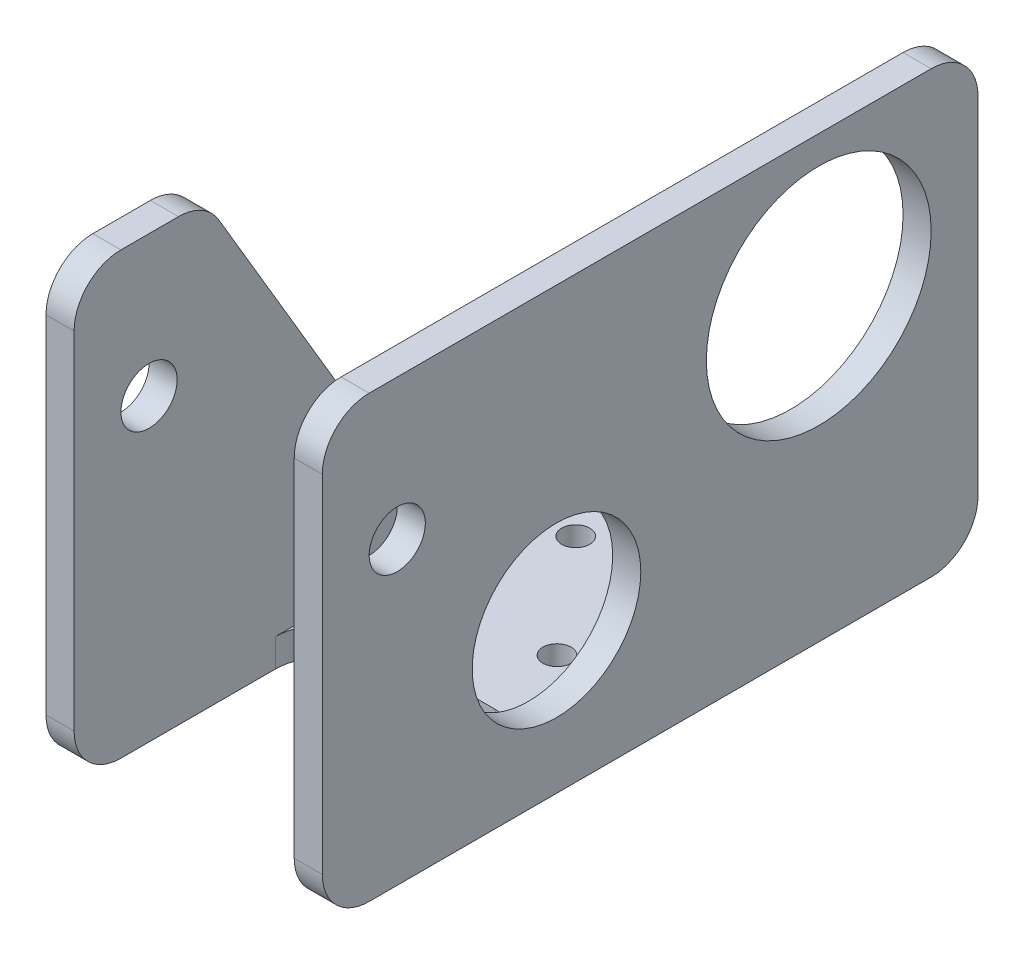
from build123d import *

# Parameters (mm, degrees)
SKETCH_1_W           = 29.5
SKETCH_1_H           = 47
EXTRUDE_1_DEPTH      = 70
SKETCH_2_W           = 23.5
SKETCH_2_H           = 44
CUT_EXTRUDE_1_DEPTH  = 70
SKETCH_5_R           = 12
SKETCH_5_R_2         = 3
CUT_EXTRUDE_4_DEPTH  = 70
SKETCH_10_R          = 9
CUT_EXTRUDE_8_DEPTH  = 17
SKETCH_11_W          = 23.5
SKETCH_11_H          = 26.5
SKETCH_11_H_2        = 15
CUT_EXTRUDE_9_DEPTH  = 10
FILLET_2_R           = 5
CUT_EXTRUDE_11_DEPTH = 10
FILLET_3_R           = 5
SKETCH_14_R          = 1.5
CUT_EXTRUDE_12_DEPTH = 10


with BuildPart() as part:
    # 草图1 → 凸台-拉伸1 (new body)
    with BuildSketch(Plane.XY):
        with Locations((14.75, 23.5)):
            Rectangle(SKETCH_1_W, SKETCH_1_H)
    extrude(amount=EXTRUDE_1_DEPTH)

    # 草图2 → 切除-拉伸1 (cut)
    with BuildSketch(Plane.XY.offset(70)):
        with Locations((14.75, 25)):
            Rectangle(SKETCH_2_W, SKETCH_2_H)
    extrude(amount=-CUT_EXTRUDE_1_DEPTH, mode=Mode.SUBTRACT)

    # 草图5 → 切除-拉伸4 (cut)
    with BuildSketch(Plane(origin=(29.5, 0, 0), x_dir=(0, 0, -1), z_dir=(1, 0, 0))):
        with Locations((-17, 32)):
            Circle(SKETCH_5_R)
        with Locations((-62, 32)):
            Circle(SKETCH_5_R_2)
    extrude(amount=-CUT_EXTRUDE_4_DEPTH, mode=Mode.SUBTRACT)

    # 草图10 → 切除-拉伸8 (cut)
    with BuildSketch(Plane(origin=(29.5, 0, 0), x_dir=(0, 0, -1), z_dir=(1, 0, 0))):
        with Locations((-45, 16)):
            Circle(SKETCH_10_R)
    extrude(amount=-CUT_EXTRUDE_8_DEPTH, mode=Mode.SUBTRACT)

    # 草图11 → 切除-拉伸9 (cut)
    with BuildSketch(Plane.XZ):
        with Locations((14.75, 56.75)):
            Rectangle(SKETCH_11_W, SKETCH_11_H)
        with Locations((14.75, 7.5)):
            Rectangle(SKETCH_11_W, SKETCH_11_H_2)
    extrude(amount=-CUT_EXTRUDE_9_DEPTH, mode=Mode.SUBTRACT)

    # 圆角2
    fillet_2_edges = [part.edges().sort_by_distance(p)[0] for p in [
        (1.5, 0, 0),
        (28, 0, 0),
        (28, 0, 70),
        (1.5, 0, 70),
        (3, 1.5, 43.5),
        (26.5, 1.5, 43.5),
    ]]
    fillet(fillet_2_edges, radius=FILLET_2_R)

    # 草图13 → 切除-拉伸11 (cut)
    with BuildSketch(Plane(origin=(3, 0, 0), x_dir=(0, 0, -1), z_dir=(1, 0, 0))):
        Polygon((-15, 0), (-15, 3), (-30, 3), (-56, 47), (0, 47), (0, 0), align=None)
    extrude(amount=-CUT_EXTRUDE_11_DEPTH, mode=Mode.SUBTRACT)

    # 圆角3
    fillet_3_edges = [part.edges().sort_by_distance(p)[0] for p in [
        (28, 47, 70),
        (0, 1.5, 15),
        (1.5, 3, 30),
        (1.5, 47, 56),
        (1.5, 47, 70),
        (28, 47, 0),
        (26.5, 1.5, 15),
    ]]
    fillet(fillet_3_edges, radius=FILLET_3_R)

    # 草图14 → 切除-拉伸12 (cut)
    with BuildSketch(Plane.XZ):
        with Locations(Location((9.75, 35.2, 0), (0, 0, 270))):
            Circle(SKETCH_14_R)
        with Locations(Location((9.75, 23.2, 0), (0, 0, 270))):
            Circle(SKETCH_14_R)
        with Locations(Location((19.75, 23.2, 0), (0, 0, 270))):
            Circle(SKETCH_14_R)
        with Locations(Location((19.75, 35.2, 0), (0, 0, 270))):
            Circle(SKETCH_14_R)
    extrude(amount=-CUT_EXTRUDE_12_DEPTH, mode=Mode.SUBTRACT)


solid = part.part
